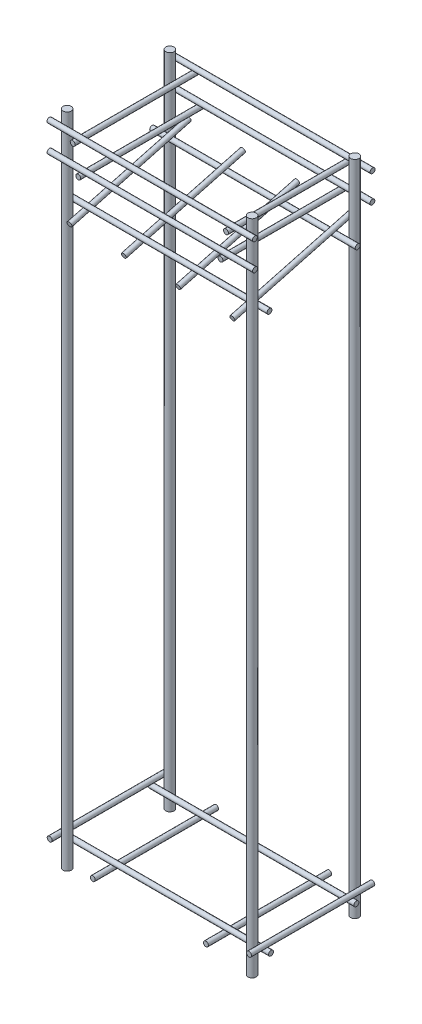
from build123d import *

# Parameters (mm, degrees)
SKETCH_1_R        = 10
EXTRUDE_1_DEPTH   = 1600
EXTRUDE_1_2_DEPTH = 1600
EXTRUDE_1_3_DEPTH = 1600
EXTRUDE_1_4_DEPTH = 1600
SKETCH_2_R        = 6
EXTRUDE_2_DEPTH   = 300
EXTRUDE_2_2_DEPTH = 300
EXTRUDE_2_3_DEPTH = 300
EXTRUDE_2_4_DEPTH = 300
SKETCH_3_R        = 6
EXTRUDE_3_DEPTH   = 500
EXTRUDE_3_2_DEPTH = 500
SKETCH_5_R        = 6
EXTRUDE_4_DEPTH   = 500
EXTRUDE_4_2_DEPTH = 500
SKETCH_6_R        = 6
EXTRUDE_5_DEPTH   = 300
EXTRUDE_5_2_DEPTH = 300
SKETCH_7_R        = 6
EXTRUDE_6_DEPTH   = 500
EXTRUDE_6_2_DEPTH = 500
SKETCH_9_R        = 6
EXTRUDE_7_DEPTH   = 300
EXTRUDE_7_2_DEPTH = 300
SKETCH_10_R       = 6
EXTRUDE_8_DEPTH   = 500
EXTRUDE_8_2_DEPTH = 500


with BuildPart() as part:
    # 草图1 → 凸台-拉伸1 (new body)
    with BuildSketch(Plane(origin=(0, 0, 0), x_dir=(1, 0, 0), z_dir=(0, 1, 0))):
        with Locations(Location((-225, -125, 0), (0, 0, 270))):
            Circle(SKETCH_1_R)
    extrude(amount=EXTRUDE_1_DEPTH)


with BuildPart() as body_2:
    # 草图1 → Extrude 1 2 (new body)
    with BuildSketch(Plane(origin=(0, 0, 0), x_dir=(1, 0, 0), z_dir=(0, 1, 0))):
        with Locations(Location((225, -125, 0), (0, 0, 270))):
            Circle(SKETCH_1_R)
    extrude(amount=EXTRUDE_1_2_DEPTH)


with BuildPart() as body_3:
    # 草图1 → Extrude 1 3 (new body)
    with BuildSketch(Plane(origin=(0, 0, 0), x_dir=(1, 0, 0), z_dir=(0, 1, 0))):
        with Locations(Location((225, 125, 0), (0, 0, 270))):
            Circle(SKETCH_1_R)
    extrude(amount=EXTRUDE_1_3_DEPTH)


with BuildPart() as body_4:
    # 草图1 → Extrude 1 4 (new body)
    with BuildSketch(Plane(origin=(0, 0, 0), x_dir=(1, 0, 0), z_dir=(0, 1, 0))):
        with Locations(Location((-225, 125, 0), (0, 0, 270))):
            Circle(SKETCH_1_R)
    extrude(amount=EXTRUDE_1_4_DEPTH)


with BuildPart() as body_5:
    # 草图2 → 凸台-拉伸2 (new body)
    with BuildSketch(Plane(origin=(0, 29.357011074, -150), x_dir=(1, 0, 0), z_dir=(0, 0, 1))):
        with Locations((-242.529677983, 35.06322708)):
            Circle(SKETCH_2_R)
    extrude(amount=EXTRUDE_2_DEPTH)


with BuildPart() as body_6:
    # 草图2 → Extrude 2 2 (new body)
    with BuildSketch(Plane(origin=(0, 29.357011074, -150), x_dir=(1, 0, 0), z_dir=(0, 0, 1))):
        with Locations(Location((242.529677983, 35.06322708, 0), (0, 0, 180))):
            Circle(SKETCH_2_R)
    extrude(amount=EXTRUDE_2_2_DEPTH)


with BuildPart() as body_7:
    # 草图2 → Extrude 2 3 (new body)
    with BuildSketch(Plane(origin=(0, 29.357011074, -150), x_dir=(1, 0, 0), z_dir=(0, 0, 1))):
        with Locations((-137.637701534, 4.243370186)):
            Circle(SKETCH_2_R)
    extrude(amount=EXTRUDE_2_3_DEPTH)


with BuildPart() as body_8:
    # 草图2 → Extrude 2 4 (new body)
    with BuildSketch(Plane(origin=(0, 29.357011074, -150), x_dir=(1, 0, 0), z_dir=(0, 0, 1))):
        with Locations(Location((137.637701534, 4.243370186, 0), (0, 0, 180))):
            Circle(SKETCH_2_R)
    extrude(amount=EXTRUDE_2_4_DEPTH)


with BuildPart() as body_9:
    # 草图3 → 凸台-拉伸3 (new body)
    with BuildSketch(Plane(origin=(-250, 0, 0), x_dir=(0, 0, -1), z_dir=(1, 0, 0))):
        with Locations((-103.903503122, 47.354697799)):
            Circle(SKETCH_3_R)
    extrude(amount=EXTRUDE_3_DEPTH)


with BuildPart() as body_10:
    # 草图3 → Extrude 3 2 (new body)
    with BuildSketch(Plane(origin=(-250, 0, 0), x_dir=(0, 0, -1), z_dir=(1, 0, 0))):
        with Locations(Location((103.903503122, 47.354697799, 0), (0, 0, 180))):
            Circle(SKETCH_3_R)
    extrude(amount=EXTRUDE_3_2_DEPTH)


with BuildPart() as body_11:
    # 草图5 → 凸台-拉伸4 (new body)
    with BuildSketch(Plane(origin=(-250, 0, 0), x_dir=(0, 0, -1), z_dir=(1, 0, 0))):
        with Locations((-143.086419347, 1572.590636067)):
            Circle(SKETCH_5_R)
    extrude(amount=EXTRUDE_4_DEPTH)


with BuildPart() as body_12:
    # 草图5 → Extrude 4 2 (new body)
    with BuildSketch(Plane(origin=(-250, 0, 0), x_dir=(0, 0, -1), z_dir=(1, 0, 0))):
        with Locations(Location((143.15912467, 1572.590636067, 0), (0, 0, 180))):
            Circle(SKETCH_5_R)
    extrude(amount=EXTRUDE_4_2_DEPTH)


with BuildPart() as body_13:
    # 草图6 → 凸台-拉伸5 (new body)
    with BuildSketch(Plane.XY.offset(-150)):
        with Locations((-186.5, 1558.920833166)):
            Circle(SKETCH_6_R)
    extrude(amount=EXTRUDE_5_DEPTH)


with BuildPart() as body_14:
    # 草图6 → Extrude 5 2 (new body)
    with BuildSketch(Plane.XY.offset(-150)):
        with Locations(Location((186.5, 1558.920833166, 0), (0, 0, 180))):
            Circle(SKETCH_6_R)
    extrude(amount=EXTRUDE_5_2_DEPTH)


with BuildPart() as body_15:
    # 草图7 → 凸台-拉伸6 (new body)
    with BuildSketch(Plane(origin=(-250, 0, 0), x_dir=(0, 0, -1), z_dir=(1, 0, 0))):
        with Locations((-142.693020427, 1506.808927116)):
            Circle(SKETCH_7_R)
    extrude(amount=EXTRUDE_6_DEPTH)


with BuildPart() as body_16:
    # 草图7 → Extrude 6 2 (new body)
    with BuildSketch(Plane(origin=(-250, 0, 0), x_dir=(0, 0, -1), z_dir=(1, 0, 0))):
        with Locations(Location((142.693020427, 1506.808927116, 0), (0, 0, 180))):
            Circle(SKETCH_7_R)
    extrude(amount=EXTRUDE_6_2_DEPTH)


with BuildPart() as body_17:
    # 草图9 → 凸台-拉伸7 (new body)
    with BuildSketch(Plane.XY.offset(-150)):
        with Locations((-173, 1494.544646119)):
            Circle(SKETCH_9_R)
    extrude(amount=EXTRUDE_7_DEPTH)


with BuildPart() as body_18:
    # 草图9 → Extrude 7 2 (new body)
    with BuildSketch(Plane.XY.offset(-150)):
        with Locations(Location((173, 1494.544646119, 0), (0, 0, 180))):
            Circle(SKETCH_9_R)
    extrude(amount=EXTRUDE_7_2_DEPTH)


with BuildPart() as body_19:
    # 草图10 → 凸台-拉伸8 (new body)
    with BuildSketch(Plane(origin=(-250, 0, 0), x_dir=(0, 0, -1), z_dir=(1, 0, 0))):
        with Locations((-107.657826454, 1401.925305204)):
            Circle(SKETCH_10_R)
    extrude(amount=EXTRUDE_8_DEPTH)


with BuildPart() as body_20:
    # 草图10 → Extrude 8 2 (new body)
    with BuildSketch(Plane(origin=(-250, 0, 0), x_dir=(0, 0, -1), z_dir=(1, 0, 0))):
        with Locations(Location((106.955510049, 1430.507187738, 0), (0, 0, 180))):
            Circle(SKETCH_10_R)
    extrude(amount=EXTRUDE_8_2_DEPTH)


with BuildPart() as body_21:
    # 草图11 → 旋转3 (revolve)
    with BuildSketch(Plane(origin=(-200, 0, 0), x_dir=(0, 0, -1), z_dir=(1, 0, 0))):
        Polygon((145.660585084, 1455.977280282), (144.107670813, 1461.77283524), (-145.670077073, 1384.127121709), (-144.117162803, 1378.331566752), align=None)
    revolve(axis=Axis((-200, 1455.977280282, -145.660585084), (0, -0.25881904510252157, 0.9659258262890681)))


with BuildPart() as body_22:
    # 草图12 → 旋转4 (revolve)
    with BuildSketch(Plane(origin=(-68, 0, 0), x_dir=(0, 0, -1), z_dir=(1, 0, 0))):
        Polygon((145.660585084, 1455.977280282), (144.107670813, 1461.77283524), (-145.670077073, 1384.127121709), (-144.117162803, 1378.331566752), align=None)
    revolve(axis=Axis((-68, 1455.977280282, -145.660585084), (0, -0.25881904510252157, 0.9659258262890681)))


with BuildPart() as body_23:
    # 草图13 → 旋转5 (revolve)
    with BuildSketch(Plane(origin=(64, 0, 0), x_dir=(0, 0, -1), z_dir=(1, 0, 0))):
        Polygon((-144.117162803, 1378.331566752), (-145.670077073, 1384.127121709), (144.107670813, 1461.77283524), (145.660585084, 1455.977280282), align=None)
    revolve(axis=Axis((64, 1455.977280282, -145.660585084), (0, -0.25881904510252157, 0.9659258262890681)))


with BuildPart() as body_24:
    # 草图14 → 旋转6 (revolve)
    with BuildSketch(Plane(origin=(196, 0, 0), x_dir=(0, 0, -1), z_dir=(1, 0, 0))):
        Polygon((-144.117162803, 1378.331566752), (-145.670077073, 1384.127121709), (144.107670813, 1461.77283524), (145.660585084, 1455.977280282), align=None)
    revolve(axis=Axis((196, 1455.977280282, -145.660585084), (0, -0.25881904510252157, 0.9659258262890681)))


solid = Compound([part.part, body_2.part, body_3.part, body_4.part, body_5.part, body_6.part, body_7.part, body_8.part, body_9.part, body_10.part, body_11.part, body_12.part, body_13.part, body_14.part, body_15.part, body_16.part, body_17.part, body_18.part, body_19.part, body_20.part, body_21.part, body_22.part, body_23.part, body_24.part])
